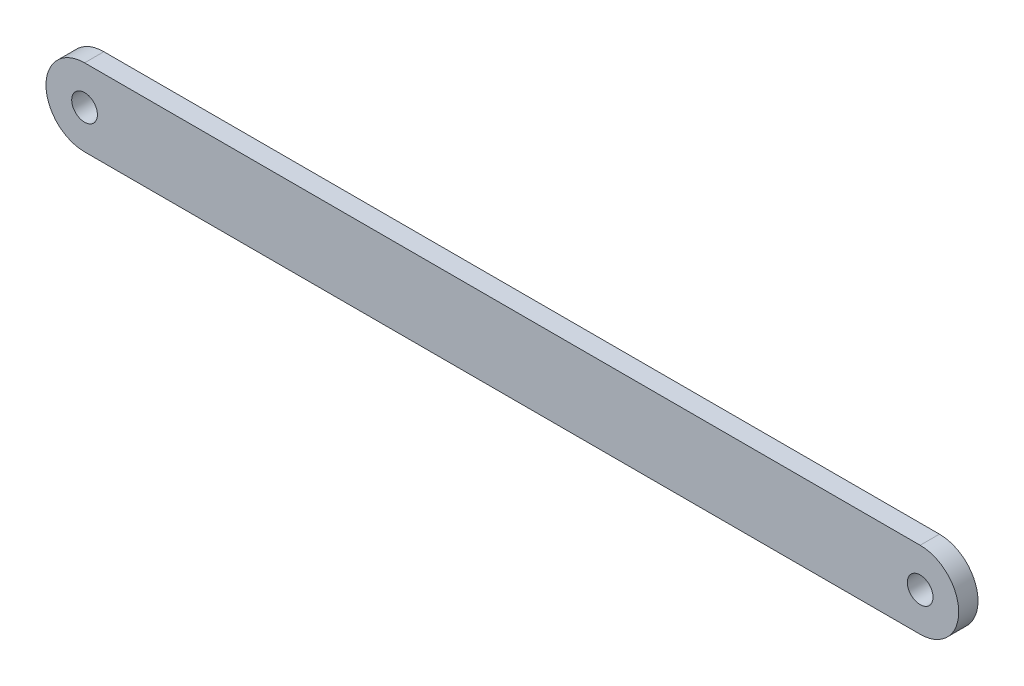
from build123d import *

# Parameters (mm, degrees)
SKETCH1_R           = 2
BOSS_EXTRUDE3_DEPTH = 3


with BuildPart() as part:
    # Sketch1 → Boss-Extrude3 (new body)
    with BuildSketch(Plane.XY):
        with BuildLine():
            Line((-35.312724167, 6), (94.687275833, 6))
            ThreePointArc((94.687275833, 6), (100.687275833, 0), (94.687275833, -6))
            Line((94.687275833, -6), (-35.312724167, -6))
            ThreePointArc((-35.312724167, -6), (-41.312724167, 0), (-35.312724167, 6))
        make_face()
        with Locations((-35.312724167, 0)):
            Circle(SKETCH1_R, mode=Mode.SUBTRACT)
        with Locations((94.687275833, 0)):
            Circle(SKETCH1_R, mode=Mode.SUBTRACT)
    extrude(amount=BOSS_EXTRUDE3_DEPTH)


solid = part.part
